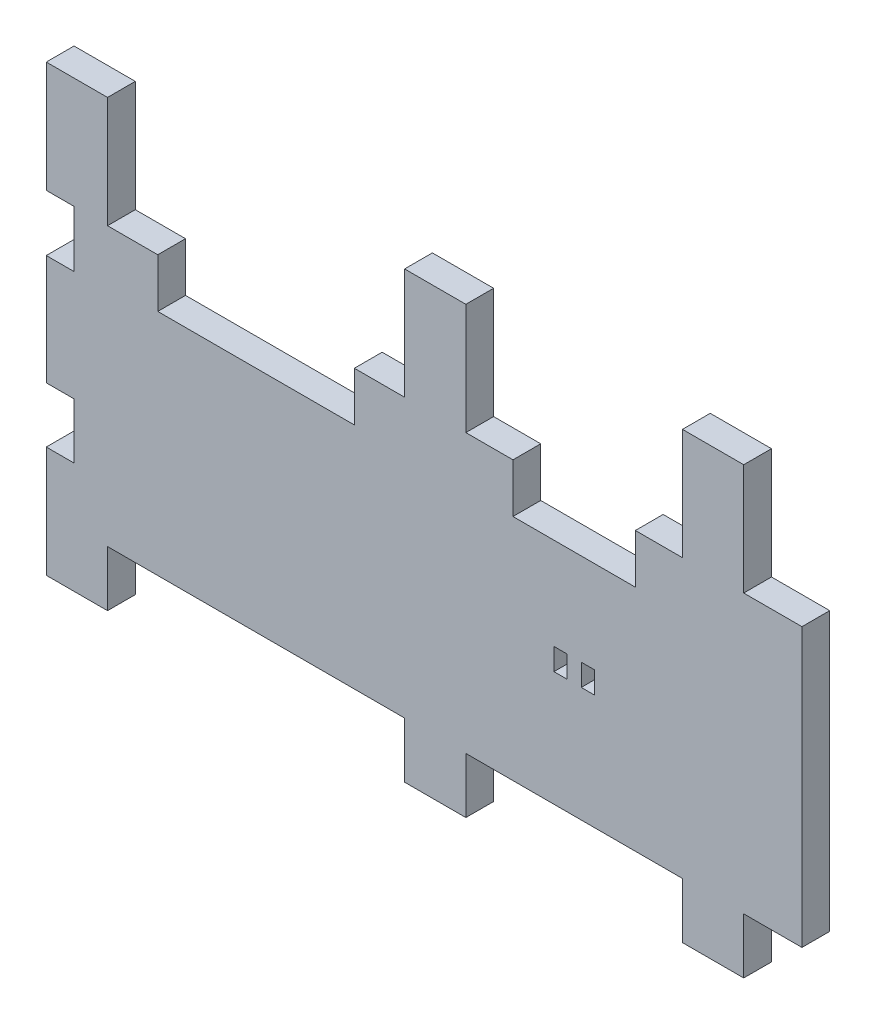
from build123d import *

# Parameters (mm, degrees)
SKETCH2_W           = 177.8
SKETCH2_H           = 101.6
BOSS_EXTRUDE3_DEPTH = 6.35
SKETCH3_W           = 6.35
SKETCH3_H           = 12.895827841
SKETCH3_W_2         = 67.9
SKETCH3_H_2         = 25.4
SKETCH3_H_3         = 12.7
SKETCH3_W_3         = 49.509
SKETCH3_W_4         = 18.391
CUT_EXTRUDE3_DEPTH  = 103.587389576
SKETCH4_W           = 44.937577928
SKETCH4_H           = 11.22448853
SKETCH4_W_2         = 5.08
SKETCH4_H_2         = 63.5
CUT_EXTRUDE4_DEPTH  = 103.587389576
SKETCH5_W           = 3
SKETCH5_H           = 5
CUT_EXTRUDE5_DEPTH  = 103.587389576


with BuildPart() as part:
    # Sketch2 → Boss-Extrude3 (new body)
    with BuildSketch(Plane.XY):
        Rectangle(SKETCH2_W, SKETCH2_H)
    extrude(amount=BOSS_EXTRUDE3_DEPTH)

    # Sketch3 → Cut-Extrude3 (cut, through all)
    with BuildSketch(Plane.XY.offset(6.35)):
        with Locations((-85.725, 18.95208608)):
            Rectangle(SKETCH3_W, SKETCH3_H)
        with Locations((-40.95, 38.1)):
            Rectangle(SKETCH3_W_2, SKETCH3_H_2)
        with Locations((-85.725, -19.05)):
            Rectangle(SKETCH3_W, SKETCH3_H_3)
        with Locations((31.7545, 38.1)):
            Rectangle(SKETCH3_W_3, SKETCH3_H_2)
        with Locations((79.7045, 38.1)):
            Rectangle(SKETCH3_W_4, SKETCH3_H_2)
        with Locations((-40.95, -44.45)):
            Rectangle(SKETCH3_W_2, SKETCH3_H_3)
        with Locations((31.7545, -44.45)):
            Rectangle(SKETCH3_W_3, SKETCH3_H_3)
        with Locations((79.7045, -44.45)):
            Rectangle(SKETCH3_W_4, SKETCH3_H_3)
    extrude(amount=-CUT_EXTRUDE3_DEPTH, mode=Mode.SUBTRACT)

    # Sketch4 → Cut-Extrude4 (cut, through all)
    with BuildSketch(Plane(origin=(0, 0, 0), x_dir=(-1, 0, 0), z_dir=(0, 0, -1))):
        with Locations((40.95, 19.787755735)):
            Rectangle(SKETCH4_W, SKETCH4_H)
        with Locations((-86.36, -6.35)):
            Rectangle(SKETCH4_W_2, SKETCH4_H_2)
        Polygon((-17.768385345, 25.4), (-31.7545, 25.4), (-45.740614655, 25.4), (-45.740614655, 14.176), (-17.768385345, 14.176), align=None)
    extrude(amount=-CUT_EXTRUDE4_DEPTH, mode=Mode.SUBTRACT)

    # Sketch5 → Cut-Extrude5 (cut, through all)
    with BuildSketch(Plane(origin=(0, 0, 0), x_dir=(-1, 0, 0), z_dir=(0, 0, -1))):
        with Locations((-28.6295, -9.35)):
            Rectangle(SKETCH5_W, SKETCH5_H)
        with Locations((-34.8795, -9.35)):
            Rectangle(SKETCH5_W, SKETCH5_H)
    extrude(amount=-CUT_EXTRUDE5_DEPTH, mode=Mode.SUBTRACT)


solid = part.part
